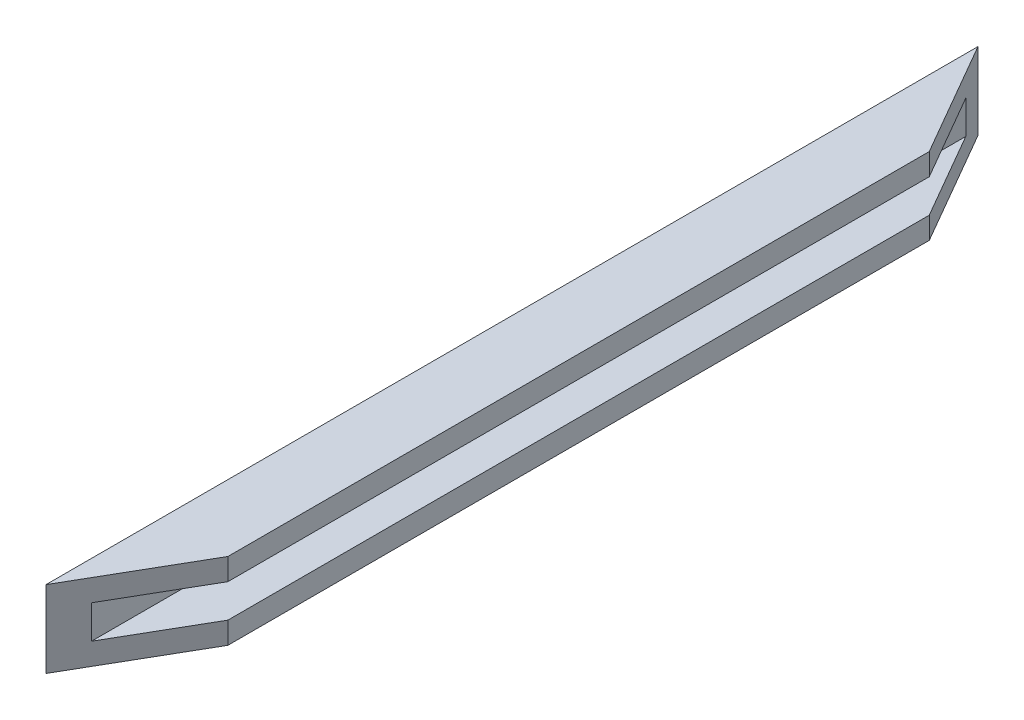
from build123d import *

# Parameters (mm, degrees)
SKETCH1_W           = 88.9
SKETCH1_H           = 7.3406
BOSS_EXTRUDE1_DEPTH = 6.35
SKETCH2_W           = 88.9
SKETCH2_H           = 3.175
CUT_EXTRUDE2_DEPTH  = 4.7625
CUT_EXTRUDE3_DEPTH  = 7.3406
SKETCH5_R           = 1.025
CUT_EXTRUDE4_DEPTH  = 1.5875


with BuildPart() as part:
    # Sketch1 → Boss-Extrude1 (new body)
    with BuildSketch(Plane(origin=(0, 0, 0), x_dir=(0, 0, -1), z_dir=(1, 0, 0))):
        with Locations((44.45, 3.6703)):
            Rectangle(SKETCH1_W, SKETCH1_H)
    extrude(amount=BOSS_EXTRUDE1_DEPTH)

    # Sketch2 → Cut-Extrude2 (cut)
    with BuildSketch(Plane(origin=(6.35, 0, 0), x_dir=(0, 0, -1), z_dir=(1, 0, 0))):
        with Locations((44.45, 3.6703)):
            Rectangle(SKETCH2_W, SKETCH2_H)
    extrude(amount=-CUT_EXTRUDE2_DEPTH, mode=Mode.SUBTRACT)

    # Sketch4 → Cut-Extrude3 (cut)
    with BuildSketch(Plane.XZ):
        Polygon((0, 0), (6.35, -10.998522628), (6.35, 0), align=None)
        Polygon((6.35, -77.901477372), (6.35, -88.9), (0, -88.9), align=None)
    extrude(amount=-CUT_EXTRUDE3_DEPTH, mode=Mode.SUBTRACT)

    # Sketch5 → Cut-Extrude4 (cut)
    with BuildSketch(Plane.ZY):
        with Locations((-76.2, 3.6703)):
            Circle(SKETCH5_R)
        with Locations((-44.45, 3.6703)):
            Circle(SKETCH5_R)
        with Locations(Location((-12.7, 3.6703, 0), (0, 0, 180))):
            Circle(SKETCH5_R)
    extrude(amount=-CUT_EXTRUDE4_DEPTH, mode=Mode.SUBTRACT)


solid = part.part
